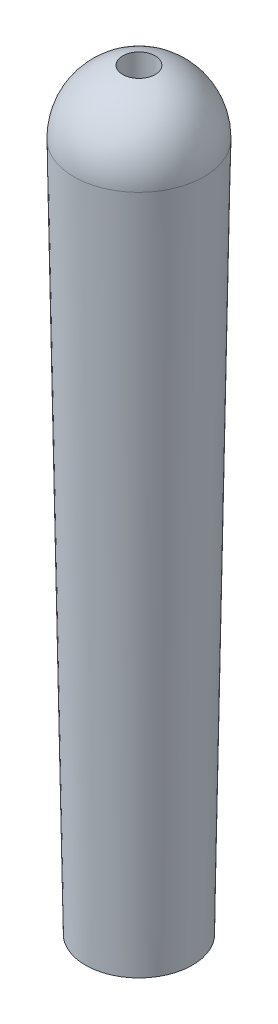
from build123d import *

# Parameters (mm, degrees)
SKETCH5_R          = 4.7625
CUT_EXTRUDE2_DEPTH = 239.324208658


with BuildPart() as part:
    # Sketch1 → Revolve1 (revolve)
    with BuildSketch(Plane.XY, mode=Mode.PRIVATE) as revolve1_sk:
        Polygon((66.717724762, 49.046294838), (66.717724762, 251.12966618), (47.613204362, 251.12966618), (51.009563545, 49.046294838), align=None)
    revolve(revolve1_sk.sketch.rotate(Axis((66.717724762, 49.046294838, 0), (0, 1, 0)), 270), axis=Axis((66.717724762, 49.046294838, 0), (0, 1, 0)))

    # Sketch4 → Revolve3 (revolve)
    with BuildSketch(Plane.XY):
        with BuildLine():
            Line((66.717724762, 251.12966618), (66.717724762, 270.557968954))
            ThreePointArc((66.717724762, 270.557968954), (53.093833538, 264.847592826), (47.613204362, 251.12966618))
            Line((47.613204362, 251.12966618), (66.717724762, 251.12966618))
        make_face()
    revolve(axis=Axis((66.717724762, 251.12966618, 0), (0, 1, 0)))

    # Sketch5 → Cut-Extrude2 (cut, through all)
    with BuildSketch(Plane.XZ.offset(-49.046294838)):
        with Locations(Location((66.717724762, 0, 0), (0, 0, 270))):
            Circle(SKETCH5_R)
    extrude(amount=-CUT_EXTRUDE2_DEPTH, mode=Mode.SUBTRACT)


solid = part.part
